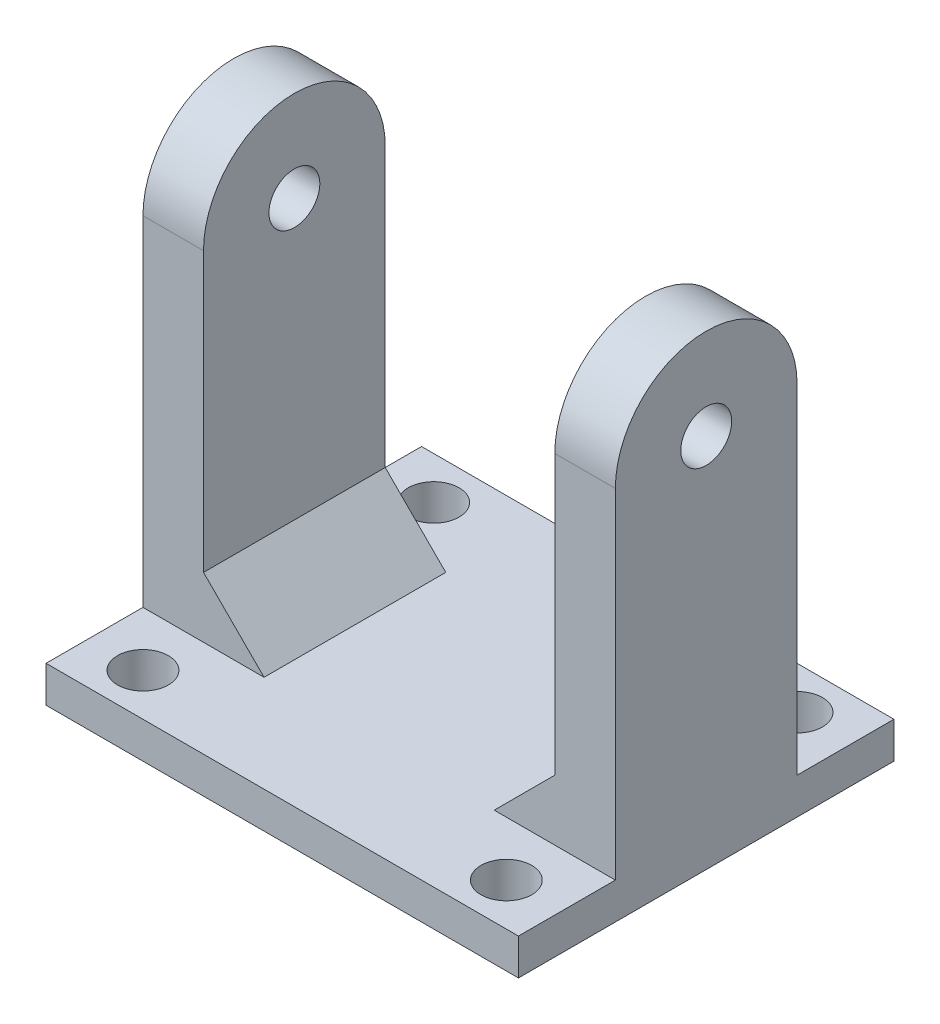
from build123d import *

# Parameters (mm, degrees)
SKETCH_1_W          = 39
SKETCH_1_H          = 31
EXTRUDE_1_DEPTH     = 3
SKETCH_5_R          = 2.1
EXTRUDE_2_DEPTH     = 5
EXTRUDE_START       = -5
SKETCH_6_R          = 2.1
EXTRUDE_3_DEPTH     = 5
SKETCH_8_R          = 2.1
CUT_EXTRUDE_1_DEPTH = 46.855752093
CHAMFER_1_SIZE      = 5


with BuildPart() as part:
    # 草图1 → 凸台-拉伸1 (new body)
    with BuildSketch(Plane(origin=(0, 0, 0), x_dir=(1, 0, 0), z_dir=(0, 1, 0))):
        Rectangle(SKETCH_1_W, SKETCH_1_H)
    extrude(amount=EXTRUDE_1_DEPTH)

    # 草图5 → 凸台-拉伸2 (add)
    with BuildSketch(Plane.ZY.offset(19.5)):
        with BuildLine():
            ThreePointArc((7.5, 31), (0, 38.5), (-7.5, 31))
            Line((-7.5, 31), (-7.5, 3))
            Line((-7.5, 3), (7.5, 3))
            Line((7.5, 3), (7.5, 31))
        make_face()
        with Locations((0, 31)):
            Circle(SKETCH_5_R, mode=Mode.SUBTRACT)
    extrude(amount=-EXTRUDE_2_DEPTH)

    # 草图6 → 凸台-拉伸3 (add)
    with BuildSketch(Plane(origin=(19.5, 0, 0), x_dir=(0, 0, -1), z_dir=(1, 0, 0)).offset(EXTRUDE_START)):
        with BuildLine():
            Line((-7.5, 31), (-7.5, 3))
            Line((-7.5, 3), (7.5, 3))
            Line((7.5, 3), (7.5, 31))
            ThreePointArc((7.5, 31), (0, 38.5), (-7.5, 31))
        make_face()
        with Locations(Location((0, 31, 0), (0, 0, 180))):
            Circle(SKETCH_6_R, mode=Mode.SUBTRACT)
    extrude(amount=EXTRUDE_3_DEPTH)

    # 草图8 → 切除-拉伸1 (cut, through all)
    with BuildSketch(Plane.XZ):
        with Locations(Location((15, 12, 0), (0, 0, 270))):
            Circle(SKETCH_8_R)
        with Locations(Location((15, -12, 0), (0, 0, 270))):
            Circle(SKETCH_8_R)
        with Locations(Location((-15, 12, 0), (0, 0, 270))):
            Circle(SKETCH_8_R)
        with Locations(Location((-15, -12, 0), (0, 0, 270))):
            Circle(SKETCH_8_R)
    extrude(amount=-CUT_EXTRUDE_1_DEPTH, mode=Mode.SUBTRACT)

    # 倒角1
    chamfer_1_edges = [part.edges().sort_by_distance(p)[0] for p in [
        (-14.5, 3, 0),
        (14.5, 3, 0),
    ]]
    chamfer(chamfer_1_edges, length=CHAMFER_1_SIZE)


solid = part.part
